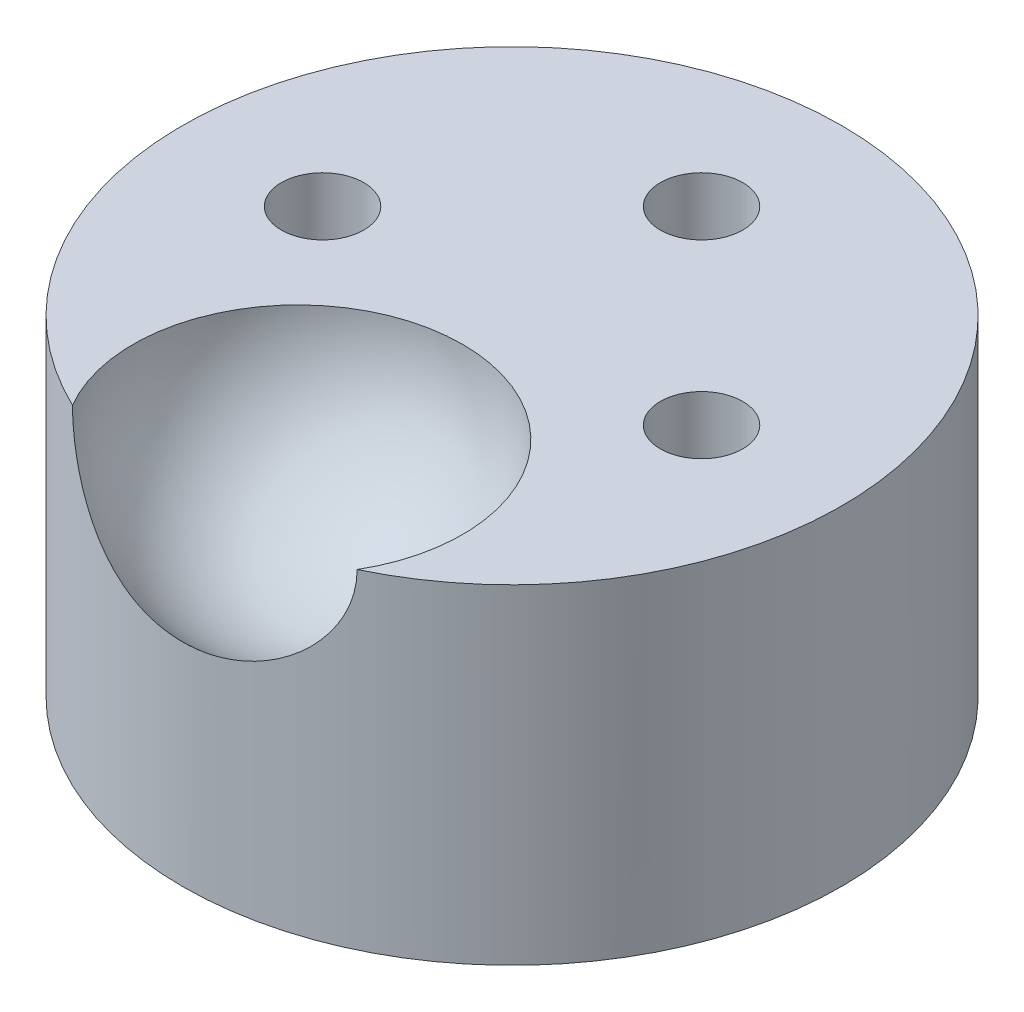
from build123d import *

# Parameters (mm, degrees)
SKETCH_1_R          = 20
EXTRUDE_1_DEPTH     = 20
SKETCH_4_R          = 2.5
CUT_EXTRUDE_1_DEPTH = 35.641016325
CHAMFER_1_SIZE      = 2
CHAMFER_1_SIZE2     = 1.154700538


with BuildPart() as part:
    # 草图1 → 凸台-拉伸1 (new body)
    with BuildSketch(Plane(origin=(0, 0, 0), x_dir=(1, 0, 0), z_dir=(0, 1, 0))):
        with Locations(Location((0, 0, 0), (0, 0, 270))):
            Circle(SKETCH_1_R)
    extrude(amount=EXTRUDE_1_DEPTH)

    # 草图2 → 切除-旋转1 (revolve, cut)
    with BuildSketch(Plane(origin=(0, 20, 0), x_dir=(1, 0, 0), z_dir=(0, 1, 0))):
        with BuildLine():
            Line((0, -3), (0, -23))
            ThreePointArc((0, -23), (-10, -13), (0, -3))
        make_face()
    revolve(axis=Axis((0, 20, 3), (0, 0, 1)), mode=Mode.SUBTRACT)

    # 草图4 → 切除-拉伸1 (cut, through all)
    with BuildSketch(Plane.XZ):
        with Locations(Location((0, -11.5, 0), (0, 0, 270))):
            Circle(SKETCH_4_R)
        with Locations(Location((11.5, 0, 0), (0, 0, 270))):
            Circle(SKETCH_4_R)
        with Locations(Location((-11.5, 0, 0), (0, 0, 270))):
            Circle(SKETCH_4_R)
    extrude(amount=-CUT_EXTRUDE_1_DEPTH, mode=Mode.SUBTRACT)

    # 倒角1
    chamfer_1_edges = [part.edges().sort_by_distance(p)[0] for p in [
        (0, 0, -9),
        (11.5, 0, 2.5),
        (-11.5, 0, 2.5),
    ]]
    chamfer_1_side = [part.faces().sort_by_distance(p)[0] for p in [
        (0, 0, 0.18852459),
    ]]
    chamfer(chamfer_1_edges, length=CHAMFER_1_SIZE, length2=CHAMFER_1_SIZE2, reference=chamfer_1_side[0])


solid = part.part
